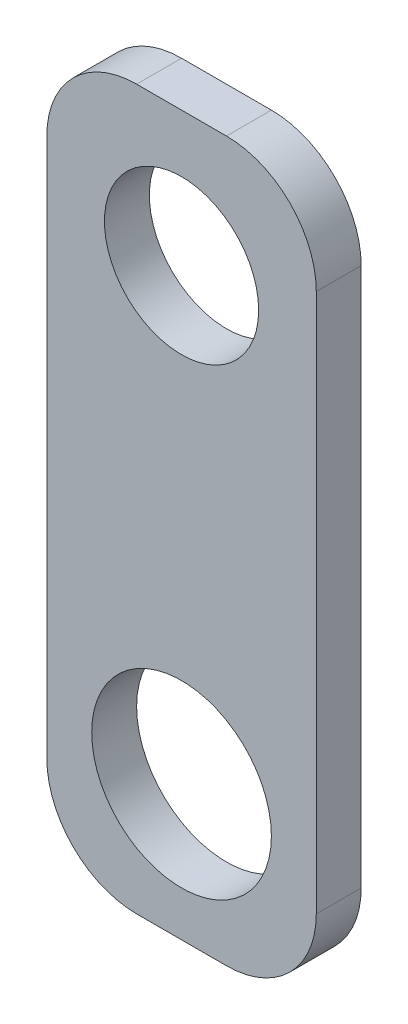
from build123d import *

# Parameters (mm, degrees)
SKETCH1_R           = 10.90295
SKETCH1_R_2         = 12.7
BOSS_EXTRUDE1_DEPTH = 6.35


with BuildPart() as part:
    # Sketch1 → Boss-Extrude1 (new body)
    with BuildSketch(Plane.XY):
        with BuildLine():
            Line((12.7, 0), (25.4, 0))
            ThreePointArc((25.4, 0), (34.380256121, 3.719743879), (38.1, 12.7))
            Line((38.1, 12.7), (38.1, 88.9))
            ThreePointArc((38.1, 88.9), (34.380256121, 97.880256121), (25.4, 101.6))
            Line((25.4, 101.6), (12.7, 101.6))
            ThreePointArc((12.7, 101.6), (3.719743879, 97.880256121), (0, 88.9))
            Line((0, 88.9), (0, 12.7))
            ThreePointArc((0, 12.7), (3.719743879, 3.719743879), (12.7, 0))
        make_face()
        with Locations((19.05, 82.55)):
            Circle(SKETCH1_R, mode=Mode.SUBTRACT)
        with Locations((19.05, 19.05)):
            Circle(SKETCH1_R_2, mode=Mode.SUBTRACT)
    extrude(amount=BOSS_EXTRUDE1_DEPTH)


solid = part.part
